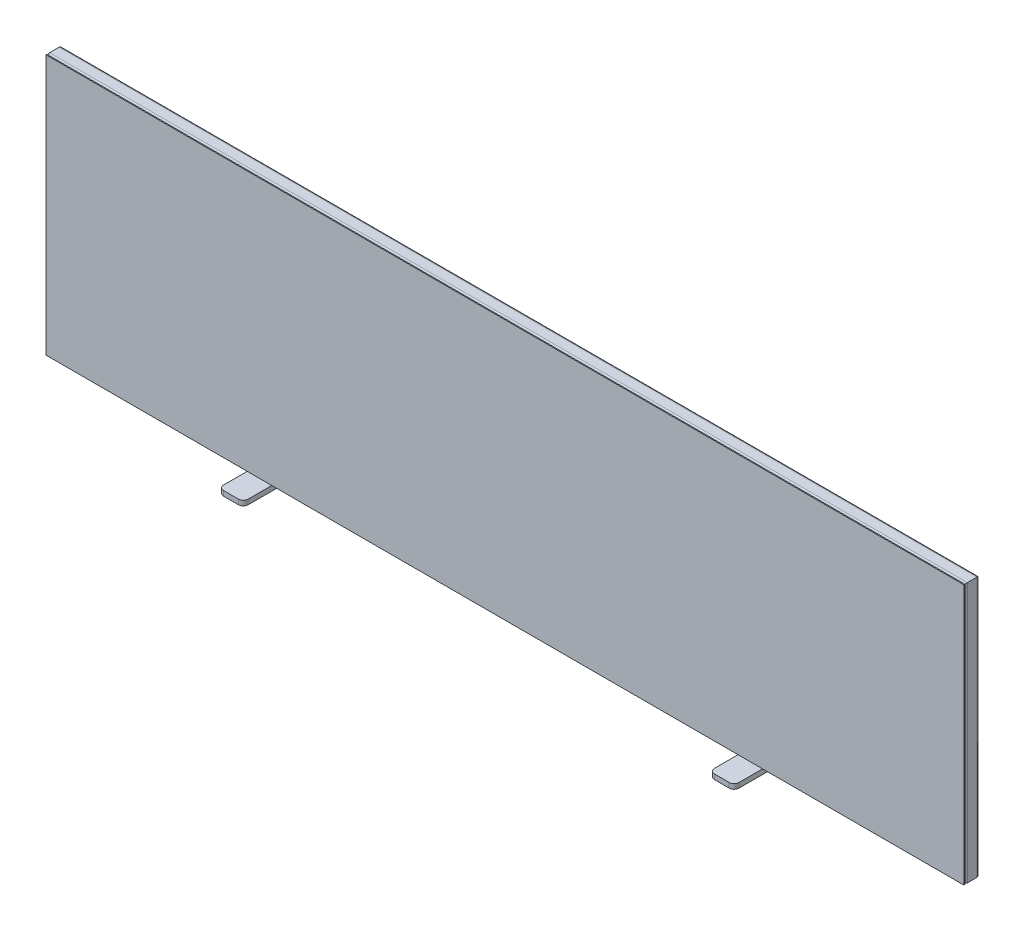
from build123d import *

# Parameters (mm, degrees)
MEMBER_1_DEPTH         = 522.213203436
MEMBER_1_DEPTH_BACK    = 22.213203436
MEMBER_1_2_DEPTH       = 1884.426406871
MEMBER_1_3_DEPTH       = 544.426406871
MEMBER_1_4_DEPTH       = 1884.426406871
SKETCH_3_W             = 1870
SKETCH_3_H             = 530
EXTRUDE_1_DEPTH        = 2
SKETCH_4_W             = 50
SKETCH_4_H             = 150
EXTRUDE_2_DEPTH        = 10
PATTERN_LINEAR_1_COUNT = 2
PATTERN_LINEAR_1_PITCH = 1000
FILLET_1_R             = 10
FILLET_2_R             = 10


with BuildPart() as part:
    # Sketch1 → Member 1 (new, two sides: drawn at the far end of the back side and taken through both)
    with BuildSketch(Plane(origin=(-920, -250, 0), x_dir=(-1, 0, 0), z_dir=(0, 1, 0)).offset(-MEMBER_1_DEPTH_BACK)):
        with BuildLine():
            Line((-9.8, -15), (9.8, -15))
            ThreePointArc((9.8, -15), (13.476955262, -13.476955262), (15, -9.8))
            Line((15, -9.8), (15, 9.8))
            ThreePointArc((15, 9.8), (13.476955262, 13.476955262), (9.8, 15))
            Line((9.8, 15), (-9.8, 15))
            ThreePointArc((-9.8, 15), (-13.476955262, 13.476955262), (-15, 9.8))
            Line((-15, 9.8), (-15, -9.8))
            ThreePointArc((-15, -9.8), (-13.476955262, -13.476955262), (-9.8, -15))
        make_face()
        with BuildLine():
            Line((-9.8, -12.5), (9.8, -12.5))
            ThreePointArc((9.8, -12.5), (11.709188309, -11.709188309), (12.5, -9.8))
            Line((12.5, -9.8), (12.5, 9.8))
            ThreePointArc((12.5, 9.8), (11.709188309, 11.709188309), (9.8, 12.5))
            Line((9.8, 12.5), (-9.8, 12.5))
            ThreePointArc((-9.8, 12.5), (-11.709188309, 11.709188309), (-12.5, 9.8))
            Line((-12.5, 9.8), (-12.5, -9.8))
            ThreePointArc((-12.5, -9.8), (-11.709188309, -11.709188309), (-9.8, -12.5))
        make_face(mode=Mode.SUBTRACT)
    extrude(amount=MEMBER_1_DEPTH + MEMBER_1_DEPTH_BACK)

    # Member 1 mitre 1
    split(bisect_by=Plane(origin=(-920, -250, 0), x_dir=(-0.707106781, -0.707106781, 0), z_dir=(-0.707106781, 0.707106781, 0)), keep=Keep.TOP)

    # Member 1 mitre 2
    split(bisect_by=Plane(origin=(-920, 250, 0), x_dir=(0.707106781, -0.707106781, 0), z_dir=(-0.707106781, -0.707106781, 0)), keep=Keep.TOP)


with BuildPart() as body_2:
    # Sketch1 on segment 2 (carried to segment 2) → Member 1 2 (new body)
    with BuildSketch(Plane(origin=(-942.213203436, 250, 0), x_dir=(0, 1, 0), z_dir=(1, 0, 0))):
        with BuildLine():
            Line((-9.8, -15), (9.8, -15))
            ThreePointArc((9.8, -15), (13.476955262, -13.476955262), (15, -9.8))
            Line((15, -9.8), (15, 9.8))
            ThreePointArc((15, 9.8), (13.476955262, 13.476955262), (9.8, 15))
            Line((9.8, 15), (-9.8, 15))
            ThreePointArc((-9.8, 15), (-13.476955262, 13.476955262), (-15, 9.8))
            Line((-15, 9.8), (-15, -9.8))
            ThreePointArc((-15, -9.8), (-13.476955262, -13.476955262), (-9.8, -15))
        make_face()
        with BuildLine():
            Line((-9.8, -12.5), (9.8, -12.5))
            ThreePointArc((9.8, -12.5), (11.709188309, -11.709188309), (12.5, -9.8))
            Line((12.5, -9.8), (12.5, 9.8))
            ThreePointArc((12.5, 9.8), (11.709188309, 11.709188309), (9.8, 12.5))
            Line((9.8, 12.5), (-9.8, 12.5))
            ThreePointArc((-9.8, 12.5), (-11.709188309, 11.709188309), (-12.5, 9.8))
            Line((-12.5, 9.8), (-12.5, -9.8))
            ThreePointArc((-12.5, -9.8), (-11.709188309, -11.709188309), (-9.8, -12.5))
        make_face(mode=Mode.SUBTRACT)
    extrude(amount=MEMBER_1_2_DEPTH)

    # Member 1 2 mitre 1
    split(bisect_by=Plane(origin=(920, 250, 0), x_dir=(-0.707106781, -0.707106781, 0), z_dir=(-0.707106781, 0.707106781, 0)), keep=Keep.TOP)

    # Member 1 2 mitre 2
    split(bisect_by=Plane(origin=(-920, 250, 0), x_dir=(-0.707106781, 0.707106781, 0), z_dir=(0.707106781, 0.707106781, 0)), keep=Keep.TOP)


with BuildPart() as body_3:
    # Sketch1 on segment 3 (carried to segment 3) → Member 1 3 (new body)
    with BuildSketch(Plane(origin=(920, 272.213203436, 0), x_dir=(1, 0, 0), z_dir=(0, -1, 0))):
        with BuildLine():
            Line((-9.8, -15), (9.8, -15))
            ThreePointArc((9.8, -15), (13.476955262, -13.476955262), (15, -9.8))
            Line((15, -9.8), (15, 9.8))
            ThreePointArc((15, 9.8), (13.476955262, 13.476955262), (9.8, 15))
            Line((9.8, 15), (-9.8, 15))
            ThreePointArc((-9.8, 15), (-13.476955262, 13.476955262), (-15, 9.8))
            Line((-15, 9.8), (-15, -9.8))
            ThreePointArc((-15, -9.8), (-13.476955262, -13.476955262), (-9.8, -15))
        make_face()
        with BuildLine():
            Line((-9.8, -12.5), (9.8, -12.5))
            ThreePointArc((9.8, -12.5), (11.709188309, -11.709188309), (12.5, -9.8))
            Line((12.5, -9.8), (12.5, 9.8))
            ThreePointArc((12.5, 9.8), (11.709188309, 11.709188309), (9.8, 12.5))
            Line((9.8, 12.5), (-9.8, 12.5))
            ThreePointArc((-9.8, 12.5), (-11.709188309, 11.709188309), (-12.5, 9.8))
            Line((-12.5, 9.8), (-12.5, -9.8))
            ThreePointArc((-12.5, -9.8), (-11.709188309, -11.709188309), (-9.8, -12.5))
        make_face(mode=Mode.SUBTRACT)
    extrude(amount=MEMBER_1_3_DEPTH)

    # Member 1 3 mitre 1
    split(bisect_by=Plane(origin=(920, -250, 0), x_dir=(-0.707106781, 0.707106781, 0), z_dir=(0.707106781, 0.707106781, 0)), keep=Keep.TOP)

    # Member 1 3 mitre 2
    split(bisect_by=Plane(origin=(920, 250, 0), x_dir=(0.707106781, 0.707106781, 0), z_dir=(0.707106781, -0.707106781, 0)), keep=Keep.TOP)


with BuildPart() as body_4:
    # Sketch1 on segment 4 (carried to segment 4) → Member 1 4 (new body)
    with BuildSketch(Plane(origin=(942.213203436, -250, 0), x_dir=(0, -1, 0), z_dir=(-1, 0, 0))):
        with BuildLine():
            Line((-9.8, -15), (9.8, -15))
            ThreePointArc((9.8, -15), (13.476955262, -13.476955262), (15, -9.8))
            Line((15, -9.8), (15, 9.8))
            ThreePointArc((15, 9.8), (13.476955262, 13.476955262), (9.8, 15))
            Line((9.8, 15), (-9.8, 15))
            ThreePointArc((-9.8, 15), (-13.476955262, 13.476955262), (-15, 9.8))
            Line((-15, 9.8), (-15, -9.8))
            ThreePointArc((-15, -9.8), (-13.476955262, -13.476955262), (-9.8, -15))
        make_face()
        with BuildLine():
            Line((-9.8, -12.5), (9.8, -12.5))
            ThreePointArc((9.8, -12.5), (11.709188309, -11.709188309), (12.5, -9.8))
            Line((12.5, -9.8), (12.5, 9.8))
            ThreePointArc((12.5, 9.8), (11.709188309, 11.709188309), (9.8, 12.5))
            Line((9.8, 12.5), (-9.8, 12.5))
            ThreePointArc((-9.8, 12.5), (-11.709188309, 11.709188309), (-12.5, 9.8))
            Line((-12.5, 9.8), (-12.5, -9.8))
            ThreePointArc((-12.5, -9.8), (-11.709188309, -11.709188309), (-9.8, -12.5))
        make_face(mode=Mode.SUBTRACT)
    extrude(amount=MEMBER_1_4_DEPTH)

    # Member 1 4 mitre 1
    split(bisect_by=Plane(origin=(920, -250, 0), x_dir=(0.707106781, -0.707106781, 0), z_dir=(-0.707106781, -0.707106781, 0)), keep=Keep.TOP)

    # Member 1 4 mitre 2
    split(bisect_by=Plane(origin=(-920, -250, 0), x_dir=(0.707106781, 0.707106781, 0), z_dir=(0.707106781, -0.707106781, 0)), keep=Keep.TOP)


with BuildPart() as body_5:
    # 草图3 → 凸台-拉伸1 (new body)
    with BuildSketch(Plane.XY.offset(15)):
        Rectangle(SKETCH_3_W, SKETCH_3_H)
    extrude(amount=EXTRUDE_1_DEPTH)


with BuildPart() as body_6:
    # 草图4 → 凸台-拉伸2 (new body)
    with BuildSketch(Plane.XZ.offset(265)):
        with Locations((-500, 0)):
            Rectangle(SKETCH_4_W, SKETCH_4_H)
    extrude_2 = extrude(amount=EXTRUDE_2_DEPTH)

    # 圆角1
    fillet_1_edges = [body_6.edges().sort_by_distance(p)[0] for p in [
        (-525, -270, 75),
        (-475, -270, 75),
        (-475, -270, -75),
        (-525, -270, -75),
    ]]
    fillet(fillet_1_edges, radius=FILLET_1_R)


with BuildPart() as pattern_linear_1_1:
    # 阵列(线性)1: 凸台-拉伸2 ×2
    with Locations(*[(i * PATTERN_LINEAR_1_PITCH, 0, 0) for i in range(1, PATTERN_LINEAR_1_COUNT)]):
        add(extrude_2)

    # 圆角2
    fillet_2_edges = [pattern_linear_1_1.edges().sort_by_distance(p)[0] for p in [
        (475, -270, 75),
        (525, -270, 75),
        (525, -270, -75),
        (475, -270, -75),
    ]]
    fillet(fillet_2_edges, radius=FILLET_2_R)


solid = Compound([part.part, body_2.part, body_3.part, body_4.part, body_5.part, body_6.part, pattern_linear_1_1.part])
